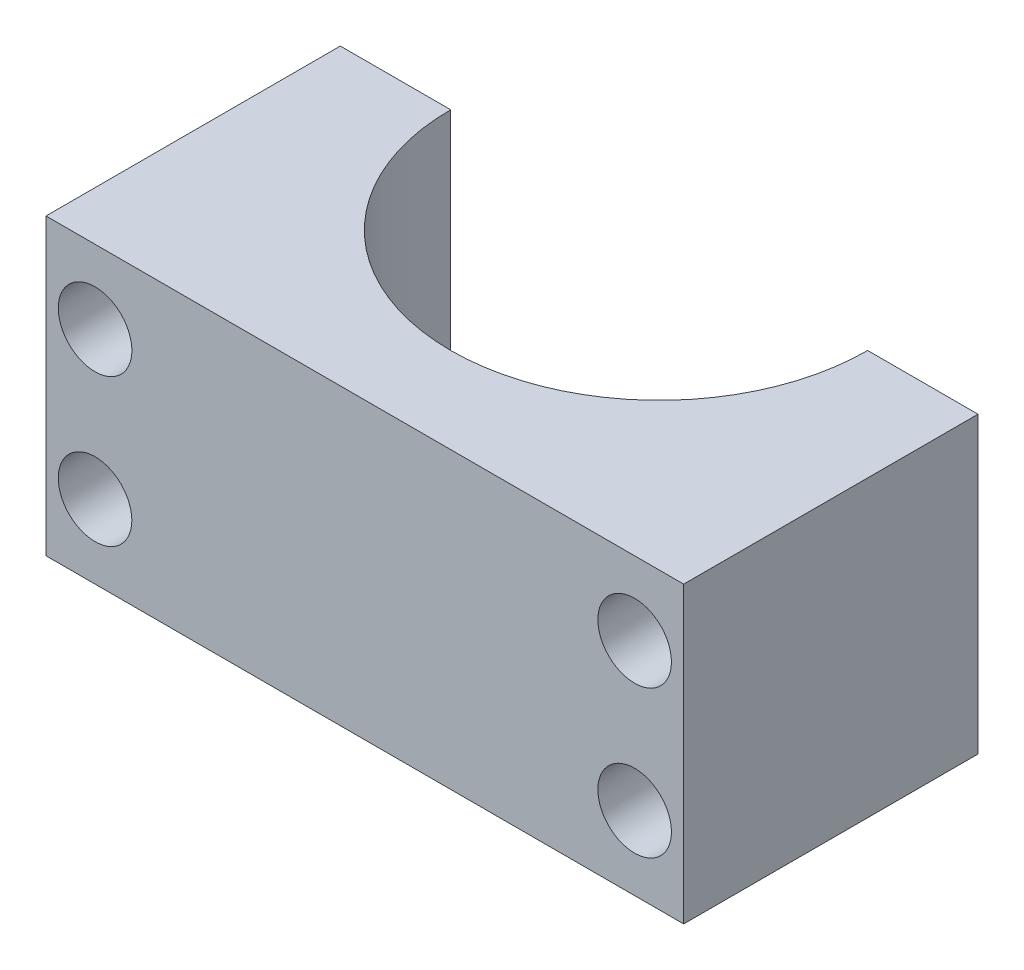
from build123d import *

# Parameters (mm, degrees)
EXTRUDE_1_DEPTH     = 12
SKETCH_2_R          = 1.5
CUT_EXTRUDE_1_DEPTH = 12


with BuildPart() as part:
    # 草图1 → 凸台-拉伸1 (new body)
    with BuildSketch(Plane(origin=(0, 0, 0), x_dir=(1, 0, 0), z_dir=(0, 1, 0))):
        with BuildLine():
            Line((-13, 0), (-8.5, 0))
            ThreePointArc((-8.5, 0), (0, -8.5), (8.5, 0))
            Line((8.5, 0), (13, 0))
            Line((13, 0), (13, -12))
            Line((13, -12), (-13, -12))
            Line((-13, -12), (-13, 0))
        make_face()
    extrude(amount=EXTRUDE_1_DEPTH)

    # 草图2 → 切除-拉伸1 (cut)
    with BuildSketch(Plane.XY.offset(12)):
        with Locations((-11, 3)):
            Circle(SKETCH_2_R)
        with Locations(Location((11, 3, 0), (0, 0, 180))):
            Circle(SKETCH_2_R)
        with Locations((11, 8.999543006)):
            Circle(SKETCH_2_R)
        with Locations(Location((-11, 8.999543006, 0), (0, 0, 180))):
            Circle(SKETCH_2_R)
    extrude(amount=-CUT_EXTRUDE_1_DEPTH, mode=Mode.SUBTRACT)


solid = part.part
